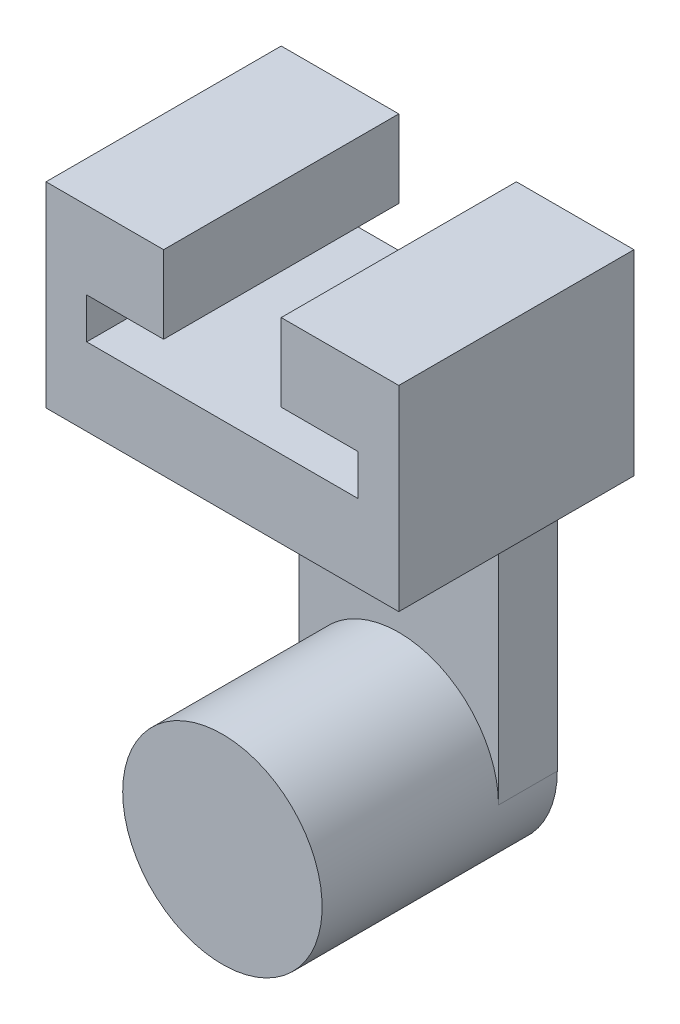
from build123d import *

# Parameters (mm, degrees)
SKETCH1_W           = 38.1
SKETCH1_H           = 8.382
BOSS_EXTRUDE1_DEPTH = 25.4
SKETCH2_W           = 4.3942
SKETCH2_H           = 4.3942
BOSS_EXTRUDE2_DEPTH = 25.4
SKETCH3_W           = 12.7
SKETCH3_H           = 8.382
BOSS_EXTRUDE3_DEPTH = 25.4
SKETCH4_W           = 21.5392
SKETCH4_H           = 31.75
BOSS_EXTRUDE4_DEPTH = 6.35
SKETCH5_R           = 10.7696
BOSS_EXTRUDE5_DEPTH = 25.4


with BuildPart() as part:
    # Sketch1 → Boss-Extrude1 (new body)
    with BuildSketch(Plane.XY):
        with Locations((-19.05, 4.191)):
            Rectangle(SKETCH1_W, SKETCH1_H)
    extrude(amount=BOSS_EXTRUDE1_DEPTH)

    # Sketch2 → Boss-Extrude2 (add)
    with BuildSketch(Plane.XY.offset(25.4)):
        with Locations((-35.9029, 10.5791)):
            Rectangle(SKETCH2_W, SKETCH2_H)
        with Locations((-2.1971, 10.5791)):
            Rectangle(SKETCH2_W, SKETCH2_H)
    extrude(amount=-BOSS_EXTRUDE2_DEPTH)

    # Sketch3 → Boss-Extrude3 (add)
    with BuildSketch(Plane.XY.offset(25.4)):
        with Locations((-31.75, 16.9672)):
            Rectangle(SKETCH3_W, SKETCH3_H)
        with Locations((-6.35, 16.9672)):
            Rectangle(SKETCH3_W, SKETCH3_H)
    extrude(amount=-BOSS_EXTRUDE3_DEPTH)


with BuildPart() as body_2:
    # Sketch4 → Boss-Extrude4 (new body)
    with BuildSketch(Plane(origin=(0, 0, 0), x_dir=(-1, 0, 0), z_dir=(0, 0, -1))):
        with Locations((19.05, -15.875)):
            Rectangle(SKETCH4_W, SKETCH4_H)
    extrude(amount=-BOSS_EXTRUDE4_DEPTH)

    # Sketch5 → Boss-Extrude5 (add)
    with BuildSketch(Plane(origin=(0, 0, 0), x_dir=(-1, 0, 0), z_dir=(0, 0, -1))):
        with Locations((19.05, -31.75)):
            Circle(SKETCH5_R)
    extrude(amount=-BOSS_EXTRUDE5_DEPTH)

    # Combine1: union part
    add(part.part)


solid = body_2.part
